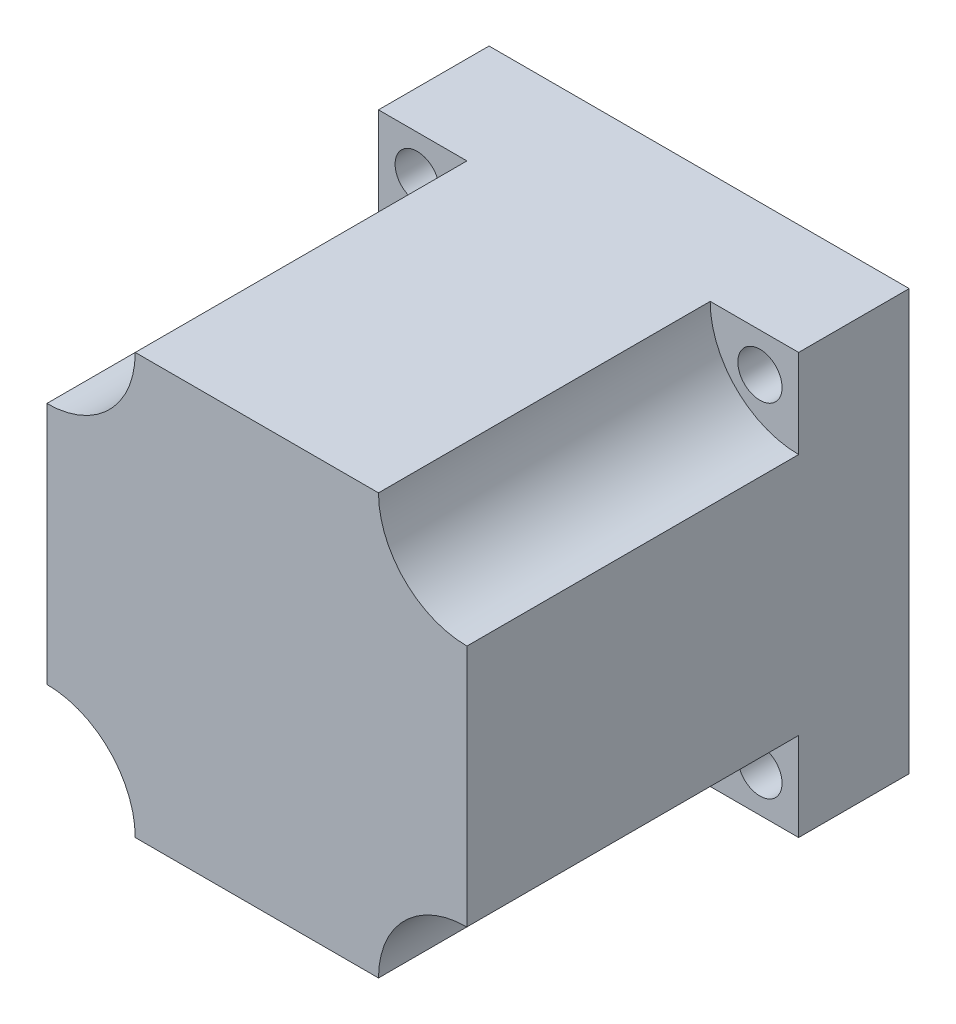
from build123d import *

# Parameters (mm, degrees)
SKETCH1_W           = 38
SKETCH1_H           = 38
BOSS_EXTRUDE1_DEPTH = 10
SKETCH2_R           = 2
CUT_EXTRUDE1_DEPTH  = 29.670542374
BOSS_EXTRUDE2_DEPTH = 30
SKETCH8_R           = 2.5
BOSS_EXTRUDE4_DEPTH = 10


with BuildPart() as part:
    # Sketch1 → Boss-Extrude1 (new body)
    with BuildSketch(Plane.XY):
        Rectangle(SKETCH1_W, SKETCH1_H)
    extrude(amount=BOSS_EXTRUDE1_DEPTH)

    # Sketch2 → Cut-Extrude1 (cut, through all)
    with BuildSketch(Plane.XY.offset(10)):
        with Locations((15.5, 15.5)):
            Circle(SKETCH2_R)
        with Locations((15.5, -15.5)):
            Circle(SKETCH2_R)
        with Locations((-15.5, -15.5)):
            Circle(SKETCH2_R)
        with Locations((-15.5, 15.5)):
            Circle(SKETCH2_R)
    extrude(amount=-CUT_EXTRUDE1_DEPTH, mode=Mode.SUBTRACT)

    # Sketch6 → Boss-Extrude2 (add)
    with BuildSketch(Plane.XY.offset(10)):
        with BuildLine():
            Line((-19, 11), (-19, -11))
            ThreePointArc((-19, -11), (-13.343145751, -13.343145751), (-11, -19))
            Line((-11, -19), (11, -19))
            ThreePointArc((11, -19), (13.343145751, -13.343145751), (19, -11))
            Line((19, -11), (19, 11))
            ThreePointArc((19, 11), (13.343145751, 13.343145751), (11, 19))
            Line((11, 19), (-11, 19))
            ThreePointArc((-11, 19), (-13.343145751, 13.343145751), (-19, 11))
        make_face()
    extrude(amount=BOSS_EXTRUDE2_DEPTH)

    # Sketch8 → Boss-Extrude4 (add)
    with BuildSketch(Plane(origin=(0, 0, 0), x_dir=(-1, 0, 0), z_dir=(0, 0, -1))):
        Circle(SKETCH8_R)
    extrude(amount=BOSS_EXTRUDE4_DEPTH)


solid = part.part
